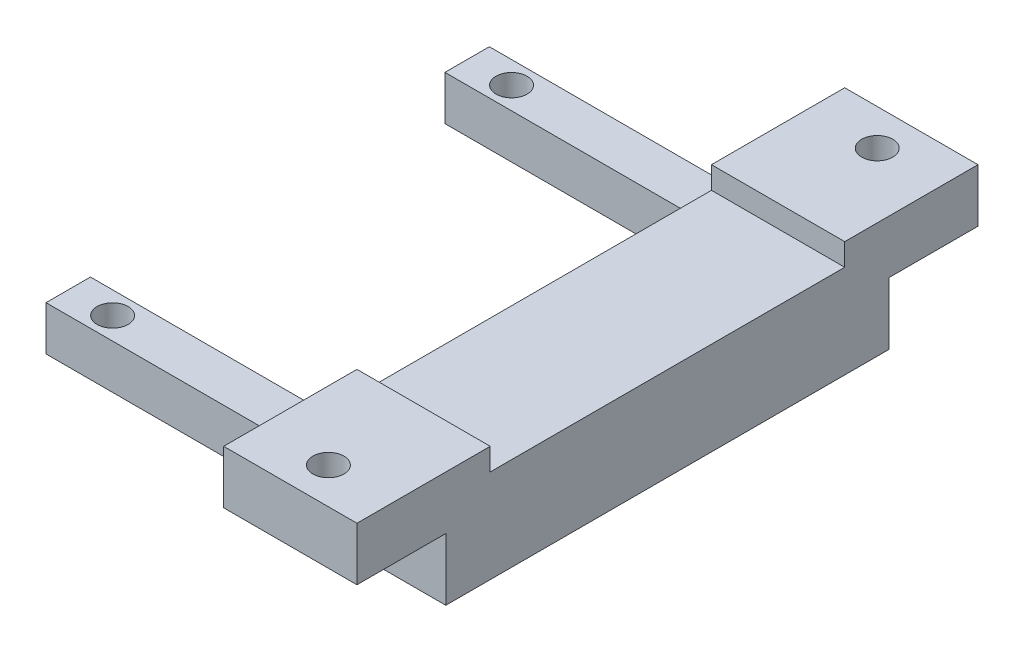
from build123d import *

# Parameters (mm, degrees)
SKETCH1_W           = 15
SKETCH1_H           = 49.9
BOSS_EXTRUDE1_DEPTH = 2
SKETCH2_W           = 45
SKETCH2_H           = 5
BOSS_EXTRUDE2_DEPTH = 5
SKETCH3_R           = 1.75
CUT_EXTRUDE1_DEPTH  = 40.642180818
SKETCH4_W           = 15
SKETCH4_H           = 49.9
BOSS_EXTRUDE3_DEPTH = 13
SKETCH5_W           = 15
SKETCH5_H           = 6
BOSS_EXTRUDE4_DEPTH = 10
SKETCH6_R           = 1.75
CUT_EXTRUDE2_DEPTH  = 48.859194519
SKETCH7_W           = 15
SKETCH7_H           = 39.9
CUT_EXTRUDE3_DEPTH  = 2.5


with BuildPart() as part:
    # Sketch1 → Boss-Extrude1 (new body)
    with BuildSketch(Plane(origin=(0, 0, 0), x_dir=(1, 0, 0), z_dir=(0, 1, 0))):
        with Locations((7.5, 0)):
            Rectangle(SKETCH1_W, SKETCH1_H)
    extrude(amount=BOSS_EXTRUDE1_DEPTH)

    # Sketch2 → Boss-Extrude2 (add)
    with BuildSketch(Plane(origin=(0, 2, 0), x_dir=(1, 0, 0), z_dir=(0, 1, 0))):
        with Locations((-7.5, -22.45)):
            Rectangle(SKETCH2_W, SKETCH2_H)
        with Locations((-7.5, 22.45)):
            Rectangle(SKETCH2_W, SKETCH2_H)
    extrude(amount=BOSS_EXTRUDE2_DEPTH)

    # Sketch3 → Cut-Extrude1 (cut, through all)
    with BuildSketch(Plane(origin=(0, 7, 0), x_dir=(1, 0, 0), z_dir=(0, 1, 0))):
        with Locations(Location((-25, -22.45, 0), (0, 0, 270))):
            Circle(SKETCH3_R)
        with Locations(Location((-25, 22.45, 0), (0, 0, 90))):
            Circle(SKETCH3_R)
    extrude(amount=-CUT_EXTRUDE1_DEPTH, mode=Mode.SUBTRACT)

    # Sketch4 → Boss-Extrude3 (add)
    with BuildSketch(Plane(origin=(0, 0, 0), x_dir=(1, 0, 0), z_dir=(0, 1, 0))):
        with Locations((7.5, 0)):
            Rectangle(SKETCH4_W, SKETCH4_H)
    extrude(amount=BOSS_EXTRUDE3_DEPTH)

    # Sketch5 → Boss-Extrude4 (add)
    with BuildSketch(Plane(origin=(0, 0, -24.95), x_dir=(-1, 0, 0), z_dir=(0, 0, -1))):
        with Locations((-7.5, 10)):
            Rectangle(SKETCH5_W, SKETCH5_H)
    boss_extrude4 = extrude(amount=BOSS_EXTRUDE4_DEPTH)

    # Sketch6 → Cut-Extrude2 (cut, through all)
    with BuildSketch(Plane(origin=(0, 13, 0), x_dir=(1, 0, 0), z_dir=(0, 1, 0))):
        with Locations(Location((7.722564817, 30.885688998, 0), (0, 0, 270))):
            Circle(SKETCH6_R)
    cut_extrude2 = extrude(amount=-CUT_EXTRUDE2_DEPTH, mode=Mode.SUBTRACT)

    # Mirror1: Boss-Extrude4, Cut-Extrude2 across plane
    add(boss_extrude4.mirror(Plane.XY))
    add(cut_extrude2.mirror(Plane.XY), mode=Mode.SUBTRACT)

    # Sketch7 → Cut-Extrude3 (cut)
    with BuildSketch(Plane(origin=(0, 13, 0), x_dir=(1, 0, 0), z_dir=(0, 1, 0))):
        with Locations((7.5, 0)):
            Rectangle(SKETCH7_W, SKETCH7_H)
    extrude(amount=-CUT_EXTRUDE3_DEPTH, mode=Mode.SUBTRACT)


solid = part.part
